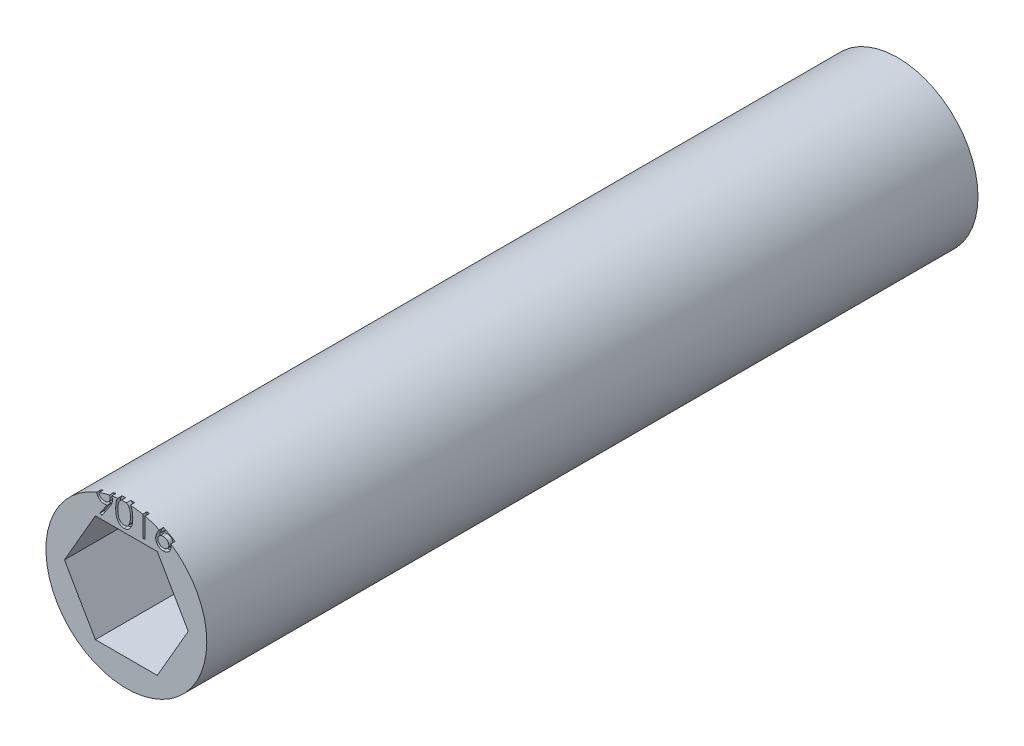
from build123d import *

# Parameters (mm, degrees)
SKETCH1_R           = 7.62
BOSS_EXTRUDE1_DEPTH = 73.0758
CUT_EXTRUDE1_DEPTH  = 0.4


with BuildPart() as part:
    # Sketch1 → Boss-Extrude1 (new body)
    with BuildSketch(Plane.XY):
        Circle(SKETCH1_R)
        Polygon((-5.865878735, 0), (-2.932939367, -5.08), (2.932939367, -5.08), (5.865878735, 0), (2.932939367, 5.08), (-2.932939367, 5.08), align=None, mode=Mode.SUBTRACT)
    extrude(amount=BOSS_EXTRUDE1_DEPTH)

    # Sketch3 → Cut-Extrude1 (cut)
    # profile 1 of 4: a face of its own
    with BuildSketch(Plane.XY.offset(73.0758)):
        with BuildLine():
            Line((-2.322362444, 5.415817308), (-2.493133178, 5.5345936))
            Line((-2.493133178, 5.5345936), (-1.831038827, 6.502453425))
            add(Edge.make_bspline(
                [(-1.831038827, 6.502453425), (-1.873282702, 6.497287431), (-1.956463248, 6.487115299), (-2.040240455, 6.485246593), (-2.081470768, 6.484326923)],
                knots=[0, 0, 0, 0, 1.015715272, 2, 2, 2, 2], degree=3))
            add(Edge.make_bspline(
                [(-2.081470768, 6.484326923), (-2.106468482, 6.484967191), (-2.15553681, 6.486223981), (-2.227676202, 6.49618564), (-2.296994771, 6.511527781), (-2.363308744, 6.534420952), (-2.426867371, 6.562872269), (-2.487531901, 6.598153559), (-2.54522067, 6.639659625), (-2.599314104, 6.687170999), (-2.648511912, 6.73933946), (-2.692342763, 6.794554281), (-2.728769854, 6.853456861), (-2.759029817, 6.914845636), (-2.781978572, 6.979602948), (-2.79868987, 7.046991915), (-2.808978472, 7.117484835), (-2.810202499, 7.165467112), (-2.810823983, 7.189829477)],
                knots=[0, 0, 0, 0, 1.060718605, 2.082097864, 3.085795603, 4.069760067, 5.054557537, 6.03741023, 7.043284206, 8.066802108, 9.088538119, 10.083643548, 11.053783639, 12.022749082, 12.983451788, 13.964007469, 14.966251758, 16, 16, 16, 16], degree=3))
            add(Edge.make_bspline(
                [(-2.810823983, 7.189829477), (-2.809643948, 7.22314565), (-2.807327778, 7.288538538), (-2.788687001, 7.384083656), (-2.758029878, 7.47442593), (-2.715284143, 7.559327829), (-2.66144427, 7.637568043), (-2.596736461, 7.7080589), (-2.5215543, 7.76979781), (-2.437610462, 7.822868441), (-2.346882782, 7.865550644), (-2.251858212, 7.897009883), (-2.153264856, 7.915514745), (-2.08647578, 7.917954411), (-2.052849974, 7.919182692)],
                knots=[0, 0, 0, 0, 1.022988612, 2.007919123, 2.978103895, 3.94594894, 4.918897164, 5.887013414, 6.875921846, 7.89917871, 8.930658928, 9.948724884, 10.967259574, 12, 12, 12, 12], degree=3))
            add(Edge.make_bspline(
                [(-2.052849974, 7.919182692), (-2.019860532, 7.917937528), (-1.954676503, 7.9154772), (-1.858821661, 7.897458643), (-1.767013576, 7.867089763), (-1.679761183, 7.82512223), (-1.598975976, 7.772516398), (-1.52633029, 7.709832017), (-1.463481932, 7.637030042), (-1.410533899, 7.555871266), (-1.368031961, 7.468671944), (-1.337366711, 7.377651097), (-1.318489768, 7.283463324), (-1.316111017, 7.219649584), (-1.314910521, 7.187444411)],
                knots=[0, 0, 0, 0, 1.026385292, 2.028040595, 3.023318987, 4.028184125, 5.03290303, 6.015178782, 7.004435299, 8.016004309, 9.023023918, 10.015172535, 10.998308025, 12, 12, 12, 12], degree=3))
            add(Edge.make_bspline(
                [(-1.314910521, 7.187444411), (-1.31571226, 7.162445527), (-1.317338387, 7.111741543), (-1.328725053, 7.03470447), (-1.348060929, 6.956156402), (-1.370003603, 6.889670816), (-1.391184595, 6.834760246), (-1.41111983, 6.791386403), (-1.433239706, 6.745733579), (-1.459038009, 6.698280479), (-1.486770928, 6.648422183), (-1.518107686, 6.596658764), (-1.552333441, 6.54292076), (-1.576710447, 6.506693723), (-1.589193123, 6.488143029)],
                knots=[0, 0, 0, 0, 1.179839688, 2.393009684, 3.667231171, 4.993948276, 5.694988576, 6.444077775, 7.246288328, 8.089075292, 8.993003841, 9.939041771, 10.944649915, 12, 12, 12, 12], degree=3))
            Line((-1.589193123, 6.488143029), (-2.322362444, 5.415817308))
        make_face()
        with BuildLine():
            add(Edge.make_bspline(
                [(-2.04187867, 6.728557692), (-2.0229416, 6.729075025), (-1.986077562, 6.730082095), (-1.93207265, 6.736211597), (-1.881097433, 6.747079613), (-1.833015743, 6.762673203), (-1.787345476, 6.781489615), (-1.744812046, 6.805446341), (-1.705379855, 6.834032659), (-1.668784855, 6.86615233), (-1.636288276, 6.90183746), (-1.607343822, 6.939187098), (-1.582741721, 6.978365199), (-1.563308492, 7.019862401), (-1.547330593, 7.062668573), (-1.536296553, 7.107473054), (-1.530183997, 7.154042412), (-1.52914198, 7.185678106), (-1.528612444, 7.201754808)],
                knots=[0, 0, 0, 0, 1.163407946, 2.26475976, 3.333800367, 4.359385343, 5.366239384, 6.363380779, 7.350133999, 8.353570782, 9.349036268, 10.310270964, 11.253520213, 12.184142, 13.120487599, 14.056272588, 15.012232024, 16, 16, 16, 16], degree=3))
            add(Edge.make_bspline(
                [(-1.528612444, 7.201754808), (-1.529068059, 7.217838223), (-1.529965902, 7.249532565), (-1.537169047, 7.29617087), (-1.549840851, 7.340865749), (-1.566843306, 7.383861892), (-1.589240825, 7.424806038), (-1.616117303, 7.464212236), (-1.648048131, 7.50183063), (-1.684789162, 7.536776483), (-1.724409456, 7.568989965), (-1.766632761, 7.59741942), (-1.811111052, 7.621246341), (-1.857572975, 7.640907962), (-1.906115334, 7.656251224), (-1.956709404, 7.667284823), (-2.00961085, 7.673388821), (-2.045520975, 7.674424252), (-2.063821279, 7.674951923)],
                knots=[0, 0, 0, 0, 0.972161553, 1.915763587, 2.844109794, 3.775983486, 4.705125789, 5.659731448, 6.655561913, 7.682237399, 8.721216875, 9.739758359, 10.754845918, 11.767244016, 12.7857855, 13.828538656, 14.893392813, 16, 16, 16, 16], degree=3))
            add(Edge.make_bspline(
                [(-2.063821279, 7.674951923), (-2.081962426, 7.6744234), (-2.117555207, 7.673386442), (-2.169986358, 7.667296426), (-2.220238332, 7.65617702), (-2.268640041, 7.640915069), (-2.315100583, 7.621244875), (-2.359576776, 7.597418172), (-2.401809957, 7.568996509), (-2.441392266, 7.536751137), (-2.478198173, 7.501993292), (-2.509580006, 7.464047441), (-2.536517994, 7.424826536), (-2.558884737, 7.383856444), (-2.575895378, 7.340867203), (-2.58856499, 7.296170476), (-2.595768724, 7.249532668), (-2.596666487, 7.217838257), (-2.59712206, 7.201754808)],
                knots=[0, 0, 0, 0, 1.099389452, 2.15699305, 3.192601482, 4.213358962, 5.227959689, 6.245255729, 7.266013209, 8.307253147, 9.336162325, 10.327954924, 11.284637477, 12.215801273, 13.149702402, 14.080068371, 15.025723358, 16, 16, 16, 16], degree=3))
            add(Edge.make_bspline(
                [(-2.59712206, 7.201754808), (-2.596709814, 7.185665587), (-2.595896789, 7.153934698), (-2.588053775, 7.107312277), (-2.574937659, 7.062620845), (-2.557371252, 7.01942585), (-2.534238028, 6.978147318), (-2.50585091, 6.938980952), (-2.472577672, 6.901482762), (-2.434863103, 6.866235355), (-2.393587086, 6.833882893), (-2.349502157, 6.805627401), (-2.30336725, 6.781765613), (-2.255019962, 6.762619421), (-2.204818586, 6.747235415), (-2.152311934, 6.736231628), (-2.097673651, 6.730140889), (-2.060655431, 6.729090488), (-2.04187867, 6.728557692)],
                knots=[0, 0, 0, 0, 0.952633368, 1.87876736, 2.791047057, 3.707742249, 4.635551637, 5.587206343, 6.568248508, 7.601284464, 8.641511608, 9.671105535, 10.699146789, 11.713763218, 12.747829548, 13.806491675, 14.887386225, 16, 16, 16, 16], degree=3))
        make_face(mode=Mode.SUBTRACT)
    # profile 2 of 4: a face of its own
    with BuildSketch(Plane.XY.offset(73.0758)):
        with BuildLine():
            add(Edge.make_bspline(
                [(-1.00962206, 6.666545974), (-1.00939889, 6.704712232), (-1.00896538, 6.778850739), (-1.004142723, 6.886881005), (-0.996131284, 6.988227201), (-0.985152107, 7.08289418), (-0.971791267, 7.170906381), (-0.953955374, 7.252028599), (-0.93367202, 7.326636296), (-0.910164017, 7.394972761), (-0.883638396, 7.457958663), (-0.854767944, 7.516758666), (-0.822406896, 7.571283802), (-0.788404747, 7.622404334), (-0.751385105, 7.669283455), (-0.712401464, 7.712583195), (-0.669932294, 7.751302831), (-0.625421283, 7.786576833), (-0.578465439, 7.817498705), (-0.530403196, 7.844735265), (-0.48090374, 7.868003389), (-0.429831927, 7.886298489), (-0.377646794, 7.901409797), (-0.324165914, 7.911743706), (-0.269300986, 7.918245817), (-0.232268171, 7.918867438), (-0.213486994, 7.919182692)],
                knots=[0, 0, 0, 0, 1.646270934, 3.197905019, 4.663502075, 6.030701355, 7.308322542, 8.50163776, 9.611534131, 10.641858119, 11.616356847, 12.558055219, 13.465016945, 14.349605745, 15.204443733, 16.039544428, 16.859896111, 17.680448484, 18.487036065, 19.28249412, 20.06191084, 20.843045899, 21.620316918, 22.403196591, 23.190181807, 24, 24, 24, 24], degree=3))
            add(Edge.make_bspline(
                [(-0.213486994, 7.919182692), (-0.194548927, 7.918850804), (-0.156887071, 7.918190782), (-0.101206387, 7.911847171), (-0.04681205, 7.901321282), (0.006064041, 7.88640719), (0.057856219, 7.867904417), (0.108159382, 7.844713004), (0.157285986, 7.817717203), (0.204455342, 7.785996315), (0.250185286, 7.750629802), (0.293352561, 7.710650201), (0.333961096, 7.666461195), (0.372520545, 7.61853557), (0.407936942, 7.56595411), (0.441664581, 7.50963135), (0.471853412, 7.448582315), (0.500928254, 7.383825604), (0.526024579, 7.313569436), (0.548657506, 7.23820984), (0.566944805, 7.156856688), (0.582177506, 7.069936814), (0.59397823, 6.977131008), (0.602572938, 6.878638212), (0.607113019, 6.774393624), (0.607968025, 6.703120874), (0.608406786, 6.666545974)],
                knots=[0, 0, 0, 0, 0.810914788, 1.612654377, 2.396697861, 3.181598691, 3.963628158, 4.749916497, 5.551656086, 6.361998678, 7.18212741, 8.025565596, 8.878627764, 9.750805457, 10.657531673, 11.591944965, 12.560506719, 13.57287815, 14.630710178, 15.753379473, 16.941251878, 18.199788006, 19.531962791, 20.947069417, 22.433333509, 24, 24, 24, 24], degree=3))
            add(Edge.make_bspline(
                [(0.608406786, 6.666545974), (0.607963476, 6.6301306), (0.607099704, 6.559176731), (0.602623834, 6.455401193), (0.593807337, 6.357431095), (0.582778756, 6.265031477), (0.567504083, 6.178586918), (0.548722711, 6.097798285), (0.527869544, 6.022316693), (0.502128372, 5.952760509), (0.473954299, 5.888159426), (0.443300675, 5.827834098), (0.410459954, 5.771251317), (0.374680826, 5.718863989), (0.336544486, 5.67030101), (0.295234704, 5.626419592), (0.251915967, 5.586162402), (0.206051448, 5.550340492), (0.158146446, 5.518986366), (0.109188574, 5.490946228), (0.058309165, 5.468336127), (0.006661246, 5.448922108), (-0.046493946, 5.434090014), (-0.101090151, 5.423834409), (-0.156849662, 5.416641777), (-0.194542512, 5.416093082), (-0.213486994, 5.415817308)],
                knots=[0, 0, 0, 0, 1.561518951, 3.042555995, 4.452378317, 5.7783523, 7.031515105, 8.214008947, 9.334062868, 10.386615937, 11.391082383, 12.354592575, 13.286541444, 14.194233754, 15.072674879, 15.931287219, 16.775624067, 17.606195743, 18.42308326, 19.229000347, 20.022332153, 20.807536673, 21.593273796, 22.3848459, 23.188221202, 24, 24, 24, 24], degree=3))
            add(Edge.make_bspline(
                [(-0.213486994, 5.415817308), (-0.23226765, 5.416134596), (-0.269299438, 5.416760226), (-0.324171892, 5.423232962), (-0.377431911, 5.433639367), (-0.429342313, 5.448210306), (-0.480169425, 5.466045757), (-0.529220648, 5.48928246), (-0.577041376, 5.516043675), (-0.623504024, 5.54652056), (-0.667735512, 5.581437633), (-0.709984742, 5.620057623), (-0.749190335, 5.663344265), (-0.785680675, 5.710614066), (-0.82036126, 5.761432147), (-0.85226278, 5.816492344), (-0.88177045, 5.875576334), (-0.908742183, 5.939065841), (-0.932655827, 6.007887319), (-0.953779357, 6.082828099), (-0.970457739, 6.16454963), (-0.984733642, 6.252395553), (-0.996248267, 6.346743352), (-1.004109335, 6.447644248), (-1.00896798, 6.555035363), (-1.009400055, 6.628697477), (-1.00962206, 6.666545974)],
                knots=[0, 0, 0, 0, 0.810891512, 1.598919785, 2.382837074, 3.152667961, 3.926044502, 4.706494248, 5.493654104, 6.291793342, 7.103789334, 7.925228297, 8.761435821, 9.622817696, 10.50288917, 11.416980706, 12.369136599, 13.353924996, 14.394355917, 15.514179734, 16.714354668, 17.994756427, 19.357759367, 20.818452758, 22.365282078, 24, 24, 24, 24], degree=3))
        make_face()
        with BuildLine():
            add(Edge.make_bspline(
                [(-0.795920137, 6.6675), (-0.79583887, 6.635694189), (-0.795681147, 6.573965355), (-0.791560768, 6.48426485), (-0.785947664, 6.400601109), (-0.778707781, 6.322867899), (-0.767956132, 6.251328337), (-0.755909193, 6.185490392), (-0.741248796, 6.125702486), (-0.723903079, 6.071554351), (-0.704146122, 6.022127038), (-0.682574811, 5.976134068), (-0.659401355, 5.933032126), (-0.633466718, 5.893208367), (-0.605221648, 5.856532924), (-0.575304128, 5.822356657), (-0.542597601, 5.791878711), (-0.497351305, 5.755325261), (-0.437618347, 5.717552422), (-0.36235693, 5.684659815), (-0.285021787, 5.663988893), (-0.232531383, 5.66136016), (-0.206331795, 5.660048077)],
                knots=[0, 0, 0, 0, 1.459021318, 2.831673884, 4.118529203, 5.306027144, 6.411944654, 7.436330062, 8.375795394, 9.233974572, 10.042671642, 10.816086306, 11.563610507, 12.285937304, 12.993564865, 13.685989202, 14.367179055, 15.041617293, 16.353048772, 17.594441528, 18.799311195, 20, 20, 20, 20], degree=3))
            add(Edge.make_bspline(
                [(-0.206331795, 5.660048077), (-0.179962737, 5.661135139), (-0.127279061, 5.663307017), (-0.050307676, 5.684261158), (0.024416133, 5.715877041), (0.082975792, 5.753260969), (0.127527309, 5.788862922), (0.159447618, 5.819216817), (0.18874519, 5.853204648), (0.216532388, 5.889875419), (0.242017937, 5.929929734), (0.265193036, 5.973174986), (0.286340814, 6.019731266), (0.29838929, 6.052231749), (0.304549364, 6.068848407)],
                knots=[0, 0, 0, 0, 1.353760809, 2.704726607, 4.075137775, 5.516104923, 6.260822281, 7.007110065, 7.778089737, 8.566572457, 9.372053459, 10.217411131, 11.088608312, 12, 12, 12, 12], degree=3))
            add(Edge.make_bspline(
                [(0.304549364, 6.068848407), (0.311728335, 6.090095784), (0.326304724, 6.13323707), (0.345090592, 6.200159483), (0.35988523, 6.270374221), (0.373195305, 6.343461666), (0.382280152, 6.41996082), (0.389592504, 6.499634985), (0.393899632, 6.582544233), (0.394433543, 6.638874397), (0.394704863, 6.6675)],
                knots=[0, 0, 0, 0, 0.884706709, 1.796334032, 2.740027952, 3.714592787, 4.726048262, 5.777819803, 6.87074269, 8, 8, 8, 8], degree=3))
            add(Edge.make_bspline(
                [(0.394704863, 6.6675), (0.394330538, 6.696120973), (0.393598278, 6.752109716), (0.390799297, 6.834105121), (0.383571472, 6.91198408), (0.375543858, 6.986082098), (0.363707534, 7.055989), (0.350945526, 7.122290011), (0.333799701, 7.184163748), (0.31548464, 7.242578928), (0.294522567, 7.296871873), (0.271447755, 7.347295717), (0.246804023, 7.394093896), (0.220037249, 7.437138011), (0.191465186, 7.476620866), (0.16033371, 7.511750832), (0.1278777, 7.543616697), (0.08241815, 7.579990338), (0.022904392, 7.61707776), (-0.051149522, 7.651208393), (-0.128214014, 7.67080832), (-0.18031131, 7.673571718), (-0.206331795, 7.674951923)],
                knots=[0, 0, 0, 0, 1.31362396, 2.569729283, 3.763502607, 4.902122613, 5.988968491, 7.01645872, 7.998833611, 8.933434873, 9.825090667, 10.667526885, 11.477055099, 12.250526234, 12.991942729, 13.710640831, 14.402115721, 15.076753259, 16.378508321, 17.609869233, 18.806226677, 20, 20, 20, 20], degree=3))
            add(Edge.make_bspline(
                [(-0.206331795, 7.674951923), (-0.232668823, 7.673569814), (-0.285390859, 7.670803077), (-0.363256342, 7.651281417), (-0.437894481, 7.617254739), (-0.497250862, 7.5798675), (-0.542742117, 7.544258756), (-0.574775164, 7.513379757), (-0.604810327, 7.479602574), (-0.632478888, 7.442589842), (-0.658393204, 7.402812512), (-0.682192785, 7.359957656), (-0.703635826, 7.313808103), (-0.723423698, 7.264402992), (-0.740822327, 7.210259528), (-0.755173755, 7.150545267), (-0.768431911, 7.08491673), (-0.777817621, 7.012989707), (-0.786161355, 6.935237028), (-0.791523486, 6.851364424), (-0.795694931, 6.761513479), (-0.795843565, 6.69946548), (-0.795920137, 6.6675)],
                knots=[0, 0, 0, 0, 1.207732386, 2.417664972, 3.655092373, 4.956220595, 5.625982001, 6.301752483, 6.994047911, 7.697131622, 8.419323945, 9.170223765, 9.943494443, 10.752040957, 11.610060368, 12.549350801, 13.567764191, 14.679664412, 15.874934091, 17.154273443, 18.533957287, 20, 20, 20, 20], degree=3))
        make_face(mode=Mode.SUBTRACT)
    # profile 3 of 4: a face of its own
    with BuildSketch(Plane.XY.offset(73.0758)):
        Polygon((1.328219737, 7.858125), (1.76850294, 7.858125), (1.76850294, 5.476875), (1.554801017, 5.476875), (1.554801017, 7.613894231), (1.188454863, 7.613894231), align=None)
    # profile 4 of 4: a face of its own
    with BuildSketch(Plane.XY.offset(73.0758)):
        with BuildLine():
            Line((3.75287794, 7.919182692), (3.917447502, 7.789912109))
            Line((3.917447502, 7.789912109), (3.288267063, 6.827776442))
            add(Edge.make_bspline(
                [(3.288267063, 6.827776442), (3.330156841, 6.834453373), (3.411867588, 6.84747748), (3.494575816, 6.849626011), (3.534882898, 6.850673077)],
                knots=[0, 0, 0, 0, 1.025318673, 2, 2, 2, 2], degree=3))
            add(Edge.make_bspline(
                [(3.534882898, 6.850673077), (3.5590849, 6.85002258), (3.606725821, 6.848742095), (3.676671163, 6.838887903), (3.743882921, 6.823358675), (3.808082518, 6.800721658), (3.869500386, 6.771804878), (3.928488981, 6.737148254), (3.983939455, 6.694962246), (4.036565883, 6.647837339), (4.08434539, 6.595642391), (4.126647313, 6.54026041), (4.162180184, 6.481749096), (4.191009585, 6.420138085), (4.213396654, 6.35552235), (4.229716819, 6.287984562), (4.239364007, 6.21747815), (4.240674028, 6.16952782), (4.241339479, 6.145170523)],
                knots=[0, 0, 0, 0, 1.04369286, 2.054478336, 3.041073146, 4.015093852, 4.984733326, 5.965804835, 6.960378782, 7.985147595, 9.009457201, 10.008161701, 10.986880575, 11.956520048, 12.937015923, 13.931873656, 14.949455224, 16, 16, 16, 16], degree=3))
            add(Edge.make_bspline(
                [(4.241339479, 6.145170523), (4.240371259, 6.111846831), (4.238466032, 6.046273693), (4.219481485, 5.950767398), (4.189981441, 5.859781526), (4.147814587, 5.774768743), (4.095439073, 5.695845566), (4.031568782, 5.625914741), (3.958468837, 5.563546376), (3.875814427, 5.511392498), (3.786862517, 5.468800065), (3.693414104, 5.438207641), (3.596376707, 5.419372995), (3.530515, 5.417011746), (3.497198854, 5.415817308)],
                knots=[0, 0, 0, 0, 1.031375318, 2.029502543, 3.004789286, 3.987476834, 4.960371455, 5.9300674, 6.912260825, 7.929083631, 8.949397511, 9.960523116, 10.96833055, 12, 12, 12, 12], degree=3))
            add(Edge.make_bspline(
                [(3.497198854, 5.415817308), (3.465156277, 5.416857033), (3.401685543, 5.418916548), (3.308318231, 5.437263016), (3.218604285, 5.466999456), (3.13317226, 5.50796667), (3.0540327, 5.559713194), (2.983230901, 5.622008245), (2.92111989, 5.69352022), (2.869430014, 5.774238028), (2.828432555, 5.860976731), (2.797687267, 5.951421475), (2.779728394, 6.045242713), (2.777218858, 6.108843274), (2.775954863, 6.140877404)],
                knots=[0, 0, 0, 0, 1.012016664, 2.004627821, 2.994792927, 3.992885782, 4.990978636, 5.973936114, 6.964471063, 7.975201453, 8.993600317, 9.990122807, 10.98767138, 12, 12, 12, 12], degree=3))
            add(Edge.make_bspline(
                [(2.775954863, 6.140877404), (2.776758668, 6.165400593), (2.778399883, 6.215472261), (2.789859404, 6.291307609), (2.808273131, 6.368903077), (2.828894923, 6.434730484), (2.850683776, 6.488656626), (2.868817021, 6.532133823), (2.891387187, 6.576874838), (2.915453719, 6.624413866), (2.943182946, 6.67352574), (2.973333415, 6.725031273), (3.006738713, 6.778111327), (3.030156716, 6.814132289), (3.042128241, 6.832546575)],
                knots=[0, 0, 0, 0, 1.173818275, 2.396712641, 3.66331629, 4.989737886, 5.693666774, 6.447286557, 7.243889047, 8.091586357, 8.998013824, 9.943181721, 10.948533338, 12, 12, 12, 12], degree=3))
            Line((3.042128241, 6.832546575), (3.75287794, 7.919182692))
        make_face()
        with BuildLine():
            add(Edge.make_bspline(
                [(3.490043655, 6.606442308), (3.471903807, 6.60591296), (3.436471413, 6.604878991), (3.384487082, 6.598874667), (3.335288245, 6.587567767), (3.288223088, 6.573167102), (3.244171526, 6.553366628), (3.202813404, 6.529314779), (3.163988789, 6.500997513), (3.128104337, 6.468816), (3.095569887, 6.433581642), (3.067552011, 6.395842556), (3.043384092, 6.35650825), (3.02373414, 6.315250072), (3.008432857, 6.272083793), (2.997364636, 6.227207946), (2.991204852, 6.180321606), (2.990180076, 6.148526814), (2.989656786, 6.132291166)],
                knots=[0, 0, 0, 0, 1.129588631, 2.206414736, 3.251139165, 4.268635594, 5.265702196, 6.250456724, 7.242448911, 8.251968645, 9.246821453, 10.222880186, 11.173611482, 12.116736599, 13.062300278, 14.020270554, 14.989073742, 16, 16, 16, 16], degree=3))
            add(Edge.make_bspline(
                [(2.989656786, 6.132291166), (2.990082936, 6.116200733), (2.990918552, 6.08464979), (2.998506112, 6.038154741), (3.010096052, 5.993411116), (3.027336571, 5.950649582), (3.047901651, 5.909218337), (3.075051523, 5.87061808), (3.105134729, 5.832504425), (3.14109428, 5.79780521), (3.179686425, 5.765517756), (3.220916886, 5.73729637), (3.263888216, 5.713153098), (3.309180559, 5.694231619), (3.356151316, 5.678702953), (3.405191836, 5.667775411), (3.456336225, 5.66159741), (3.49098133, 5.6605713), (3.508647171, 5.660048077)],
                knots=[0, 0, 0, 0, 0.989467248, 1.94019797, 2.891935182, 3.827694429, 4.772920941, 5.730924762, 6.725747692, 7.756678648, 8.79901574, 9.819492441, 10.826891316, 11.826466727, 12.835195252, 13.867842842, 14.912794438, 16, 16, 16, 16], degree=3))
            add(Edge.make_bspline(
                [(3.508647171, 5.660048077), (3.526312983, 5.660571341), (3.560958031, 5.661597531), (3.612102831, 5.667774949), (3.66114183, 5.678704647), (3.708118116, 5.694225478), (3.753390054, 5.71317588), (3.796323802, 5.737146169), (3.837164344, 5.765691313), (3.875781823, 5.797750033), (3.911591699, 5.83270192), (3.942396419, 5.870277856), (3.968714833, 5.90953031), (3.990101307, 5.950486374), (4.007151936, 5.993436972), (4.018800648, 6.038147814), (4.026372539, 6.084651603), (4.027210308, 6.116201346), (4.027637556, 6.132291166)],
                knots=[0, 0, 0, 0, 1.087397944, 2.132534446, 3.165364764, 4.174271784, 5.174024072, 6.181601208, 7.194203697, 8.236725232, 9.267838612, 10.269026844, 11.221737037, 12.171628256, 13.107553087, 14.05945871, 15.010357665, 16, 16, 16, 16], degree=3))
            add(Edge.make_bspline(
                [(4.027637556, 6.132291166), (4.02726316, 6.148547994), (4.026528343, 6.180454861), (4.018217135, 6.227186973), (4.00669027, 6.272311801), (3.989284672, 6.315545741), (3.966671951, 6.356718185), (3.939128776, 6.396037113), (3.907265903, 6.433803974), (3.870460255, 6.468885099), (3.830393864, 6.500961951), (3.787792903, 6.529278113), (3.743224085, 6.553175642), (3.696732599, 6.573114938), (3.647785745, 6.587504134), (3.597173747, 6.598834287), (3.54424928, 6.604863624), (3.508342337, 6.605909377), (3.490043655, 6.606442308)],
                knots=[0, 0, 0, 0, 0.978206639, 1.919901502, 2.851605144, 3.780102724, 4.718870031, 5.675451981, 6.667674623, 7.690630536, 8.733308323, 9.756129687, 10.767539656, 11.776269907, 12.797430371, 13.836405707, 14.897401972, 16, 16, 16, 16], degree=3))
        make_face(mode=Mode.SUBTRACT)
    extrude(amount=-CUT_EXTRUDE1_DEPTH, mode=Mode.SUBTRACT)


solid = part.part
